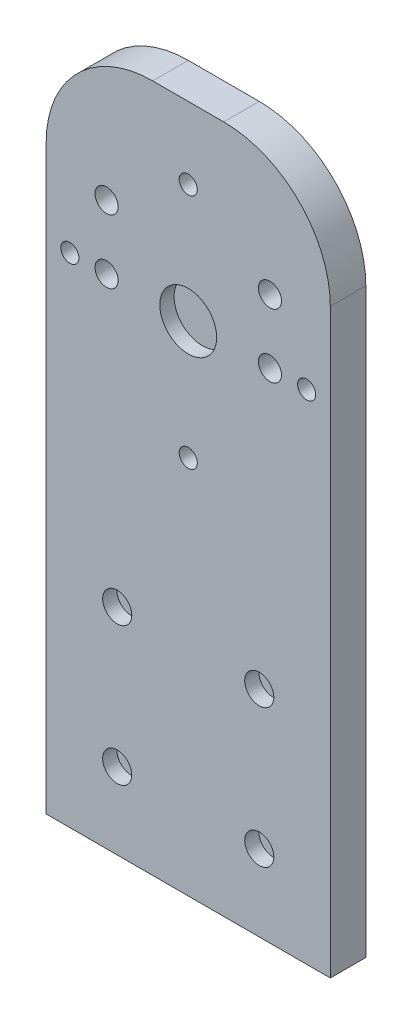
from build123d import *

# Parameters (mm, degrees)
SKETCH1_W                = 80
SKETCH1_H                = 193.756044748
BOSS_EXTRUDE1_DEPTH      = 10
SCHIZZO2_R               = 2.549999997
SCHIZZO2_R_2             = 2.55
TAGLIO_ESTRUSIONE4_DEPTH = 2637.837278588
SCHIZZO3_R               = 3.25
TAGLIO_ESTRUSIONE5_DEPTH = 2637.837278588
SCHIZZO6_R               = 4.1
TAGLIO_ESTRUSIONE6_DEPTH = 4
RACCORDO1_R              = 30
SCHIZZO7_R               = 8
TAGLIO_ESTRUSIONE7_DEPTH = 4


with BuildPart() as part:
    # Sketch1 → Boss-Extrude1 (new body)
    with BuildSketch(Plane.XY):
        with Locations((1780.42117355, -1810.70620503)):
            Rectangle(SKETCH1_W, SKETCH1_H)
    extrude(amount=BOSS_EXTRUDE1_DEPTH)

    # Schizzo2 → Taglio-Estrusione4 (cut, through all)
    with BuildSketch(Plane.XY.offset(10)):
        with Locations((1747.088159885, -1767.419409113)):
            Circle(SCHIZZO2_R)
        with Locations((1780.42117355, -1734.086395448)):
            Circle(SCHIZZO2_R_2)
        with Locations((1813.754187215, -1767.419409113)):
            Circle(SCHIZZO2_R_2)
        with Locations((1780.42117355, -1800.752422779)):
            Circle(SCHIZZO2_R_2)
    extrude(amount=-TAGLIO_ESTRUSIONE4_DEPTH, mode=Mode.SUBTRACT)

    # Schizzo3 → Taglio-Estrusione5 (cut, through all)
    with BuildSketch(Plane.XY.offset(10)):
        with Locations((1803.421173548, -1749.419409113)):
            Circle(SCHIZZO3_R)
        with Locations((1803.421173548, -1767.419409113)):
            Circle(SCHIZZO3_R)
        with Locations((1757.421173548, -1749.419409113)):
            Circle(SCHIZZO3_R)
        with Locations((1757.421173548, -1767.419409113)):
            Circle(SCHIZZO3_R)
    extrude(amount=-TAGLIO_ESTRUSIONE5_DEPTH, mode=Mode.SUBTRACT)

    # Schizzo6 → Taglio-Estrusione6 (cut)
    with BuildSketch(Plane.XY.offset(10)):
        with Locations((1760.42117355, -1847.116784923)):
            Circle(SCHIZZO6_R)
        with Locations((1800.42117355, -1847.116784923)):
            Circle(SCHIZZO6_R)
        with Locations(Location((1800.42117355, -1886.070299533, 0), (0, 0, 180))):
            Circle(SCHIZZO6_R)
        with Locations(Location((1760.42117355, -1886.070299533, 0), (0, 0, 180))):
            Circle(SCHIZZO6_R)
    extrude(amount=-TAGLIO_ESTRUSIONE6_DEPTH, mode=Mode.SUBTRACT)

    # Raccordo1
    raccordo1_edges = [part.edges().sort_by_distance(p)[0] for p in [
        (1740.42117355, -1713.828182656, 5),
        (1820.42117355, -1713.828182656, 5),
    ]]
    fillet(raccordo1_edges, radius=RACCORDO1_R)

    # Schizzo7 → Taglio-Estrusione7 (cut)
    with BuildSketch(Plane.XY.offset(10)):
        with Locations((1780.42117355, -1767.419409113)):
            Circle(SCHIZZO7_R)
    extrude(amount=-TAGLIO_ESTRUSIONE7_DEPTH, mode=Mode.SUBTRACT)


solid = part.part
